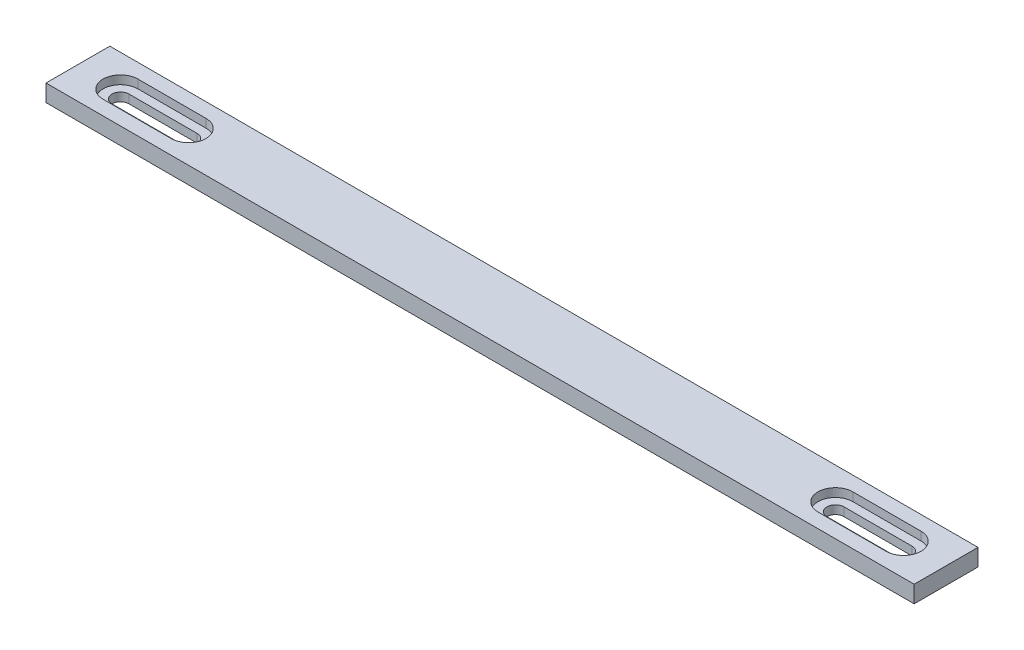
from build123d import *

# Parameters (mm, degrees)
SKETCH1_W           = 15
SKETCH1_H           = 4
BOSS_EXTRUDE1_DEPTH = 204
CUT_EXTRUDE1_DEPTH  = 205.58983357
CUT_EXTRUDE2_DEPTH  = 2


with BuildPart() as part:
    # Sketch1 → Boss-Extrude1 (new body)
    with BuildSketch(Plane(origin=(0, 0, 0), x_dir=(0, 0, -1), z_dir=(1, 0, 0))):
        with Locations((7.5, -2)):
            Rectangle(SKETCH1_W, SKETCH1_H)
    extrude(amount=BOSS_EXTRUDE1_DEPTH)

    # Sketch3 → Cut-Extrude1 (cut, through all)
    with BuildSketch(Plane(origin=(0, 0, 0), x_dir=(1, 0, 0), z_dir=(0, 1, 0))):
        with BuildLine():
            Line((10, 9.5), (26, 9.5))
            ThreePointArc((26, 9.5), (28, 7.5), (26, 5.5))
            Line((26, 5.5), (10, 5.5))
            ThreePointArc((10, 5.5), (8, 7.5), (10, 9.5))
        make_face()
        with BuildLine():
            Line((178, 9.5), (194, 9.5))
            ThreePointArc((194, 9.5), (196, 7.5), (194, 5.5))
            Line((194, 5.5), (178, 5.5))
            ThreePointArc((178, 5.5), (176, 7.5), (178, 9.5))
        make_face()
    extrude(amount=-CUT_EXTRUDE1_DEPTH, mode=Mode.SUBTRACT)

    # Sketch4 → Cut-Extrude2 (cut)
    with BuildSketch(Plane(origin=(0, 0, 0), x_dir=(1, 0, 0), z_dir=(0, 1, 0))):
        with BuildLine():
            Line((10, 11.6), (26, 11.6))
            ThreePointArc((26, 11.6), (30.1, 7.5), (26, 3.4))
            Line((26, 3.4), (10, 3.4))
            ThreePointArc((10, 3.4), (5.9, 7.5), (10, 11.6))
        make_face()
        with BuildLine():
            Line((178, 11.6), (194, 11.6))
            ThreePointArc((194, 11.6), (198.1, 7.5), (194, 3.4))
            Line((194, 3.4), (178, 3.4))
            ThreePointArc((178, 3.4), (173.9, 7.5), (178, 11.6))
        make_face()
    extrude(amount=-CUT_EXTRUDE2_DEPTH, mode=Mode.SUBTRACT)


solid = part.part
